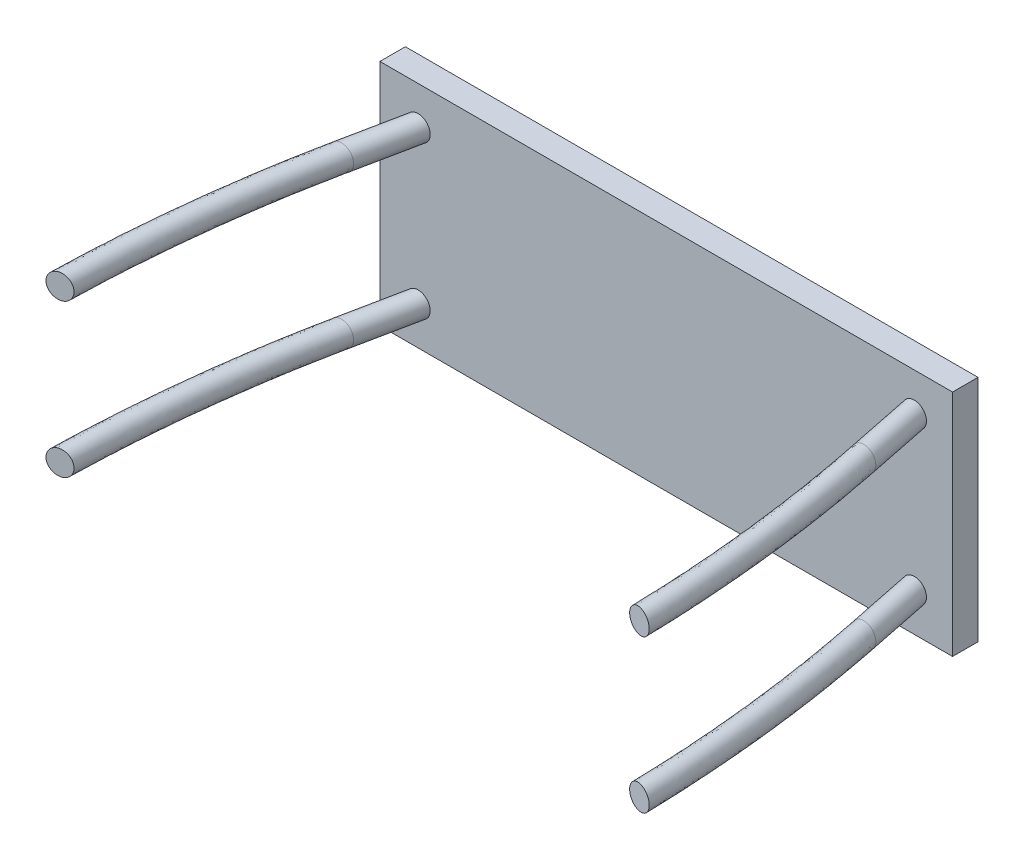
from build123d import *

# Parameters (mm, degrees)
SKETCH1_W               = 1143
SKETCH1_H               = 457.2
TABLETOP_DEPTH          = 50.8
PROFILE_R               = 24.13
MIRROR2_COPY_1_SKETCH_R = 24.13


with BuildPart() as part:
    # Sketch1 → TableTop (new body)
    with BuildSketch(Plane.XY):
        with Locations((571.5, 228.6)):
            Rectangle(SKETCH1_W, SKETCH1_H)
    extrude(amount=TABLETOP_DEPTH)

    # Sweep1: sweep along a path in Sketch11
    with BuildLine(Plane(origin=(0, 381, 0), x_dir=(1, 0, 0), z_dir=(0, 1, 0))) as sweep1_path:
        Line((76.2, -50.8), (50.297706266, -177.8))
        ThreePointArc((50.297706266, -177.8), (10.572817848, -428.926986426), (-6.770877712, -682.584287318))
    # Profile → Sweep1 (sweep)
    with BuildSketch(Plane.XY.offset(50.8)):
        with Locations((76.2, 381)):
            Circle(PROFILE_R)
    sweep1 = sweep(path=sweep1_path.line)

    # Mirror1: Sweep1 across plane
    add(sweep1.mirror(Plane(origin=(571.5, 0, 0), x_dir=(0, 0, 1), z_dir=(1, 0, 0))))

    # Mirror2: Sweep1 across plane
    add(sweep1.mirror(Plane.ZX.offset(228.6)))

    # Mirror2 copy 1: sweep along a path in Mirror2 copy 1 path
    with BuildLine(Plane(origin=(1143, 76.2, 0), x_dir=(-1, 0, 0), z_dir=(0, -1, 0))) as mirror2_copy_1_path:
        Line((76.2, -50.8), (50.297706266, -177.8))
        ThreePointArc((50.297706266, -177.8), (10.572817848, -428.926986426), (-6.770877712, -682.584287318))
    # Mirror2 copy 1 sketch → Mirror2 copy 1 (sweep)
    with BuildSketch(Plane(origin=(1143, 457.2, 50.8), x_dir=(-1, 0, 0), z_dir=(0, 0, 1))):
        with Locations((76.2, 381)):
            Circle(MIRROR2_COPY_1_SKETCH_R)
    sweep(path=mirror2_copy_1_path.line)


solid = part.part
